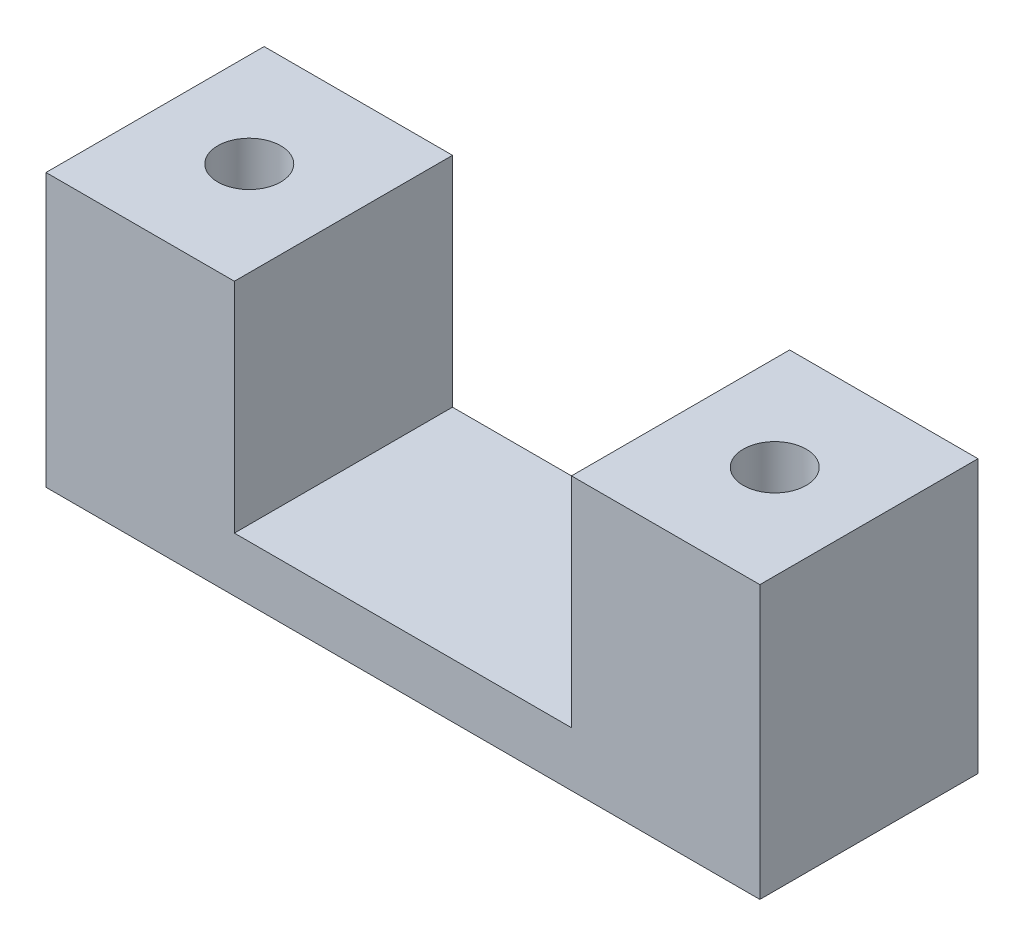
from build123d import *

# Parameters (mm, degrees)
SKETCH1_W           = 72
SKETCH1_H           = 22
BOSS_EXTRUDE1_DEPTH = 27.5
SKETCH2_W           = 34
SKETCH2_H           = 22
CUT_EXTRUDE1_DEPTH  = 22
SKETCH3_R           = 3.175
CUT_EXTRUDE2_DEPTH  = 69
SKETCH5_R           = 5.5
CUT_EXTRUDE3_DEPTH  = 5.5


with BuildPart() as part:
    # Sketch1 → Boss-Extrude1 (new body)
    with BuildSketch(Plane(origin=(0, 0, 0), x_dir=(1, 0, 0), z_dir=(0, 1, 0))):
        with Locations((36, 11)):
            Rectangle(SKETCH1_W, SKETCH1_H)
    extrude(amount=BOSS_EXTRUDE1_DEPTH)

    # Sketch2 → Cut-Extrude1 (cut)
    with BuildSketch(Plane(origin=(0, 27.5, 0), x_dir=(1, 0, 0), z_dir=(0, 1, 0))):
        with Locations((36, 11)):
            Rectangle(SKETCH2_W, SKETCH2_H)
    extrude(amount=-CUT_EXTRUDE1_DEPTH, mode=Mode.SUBTRACT)

    # Sketch3 → Cut-Extrude2 (cut)
    with BuildSketch(Plane(origin=(0, 27.5, 0), x_dir=(1, 0, 0), z_dir=(0, 1, 0))):
        with Locations(Location((9.5, 11, 0), (0, 0, 270))):
            Circle(SKETCH3_R)
        with Locations(Location((62.5, 11, 0), (0, 0, 270))):
            Circle(SKETCH3_R)
    extrude(amount=-CUT_EXTRUDE2_DEPTH, mode=Mode.SUBTRACT)

    # Sketch5 → Cut-Extrude3 (cut)
    with BuildSketch(Plane.XZ):
        with Locations(Location((9.5, -11, 0), (0, 0, 270))):
            Circle(SKETCH5_R)
        with Locations(Location((62.5, -11, 0), (0, 0, 90))):
            Circle(SKETCH5_R)
    extrude(amount=-CUT_EXTRUDE3_DEPTH, mode=Mode.SUBTRACT)


solid = part.part
